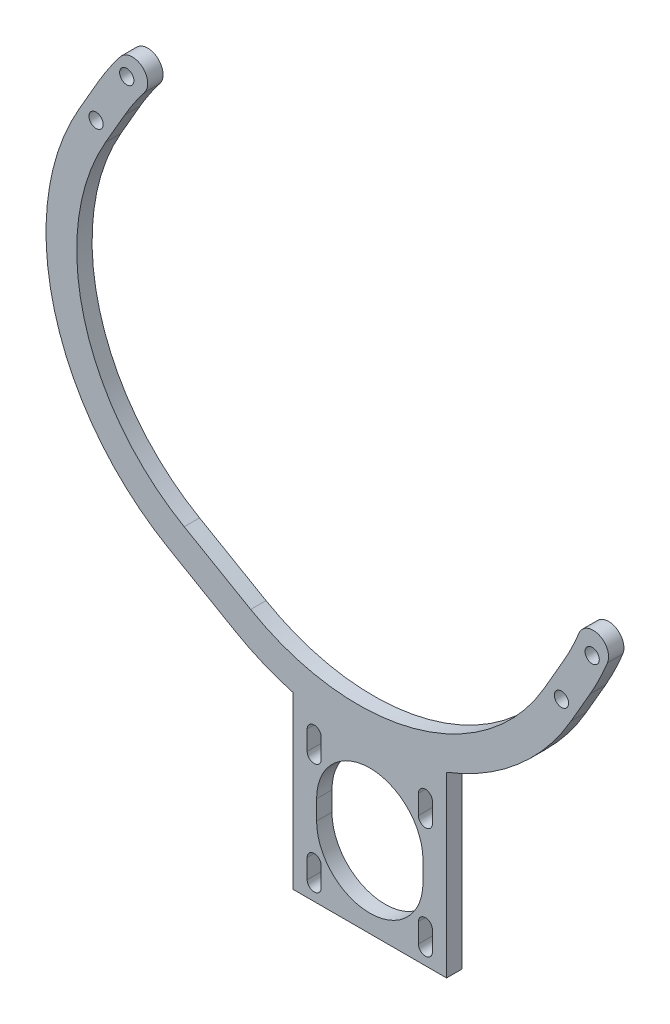
from build123d import *

# Parameters (mm, degrees)
BOSS_EXTRUDE1_DEPTH      = 3.175
BOSS_EXTRUDE2_DEPTH      = 3.175
BOSS_EXTRUDE2_DEPTH_BACK = 34.925
SKETCH2_W                = 31.75
SKETCH2_H                = 3.175
CUT_EXTRUDE1_DEPTH       = 111.671398355
F_4_CLEARANCE_HOLE1_D    = 2.9464


with BuildPart() as part:
    # Sketch1 → Boss-Extrude1 (new body)
    with BuildSketch(Plane(origin=(0, 0, -14.15699402), x_dir=(-1, 0, 0), z_dir=(0, 0, -1))):
        with BuildLine():
            Line((-49.172312317, -34.502108483), (-53.141062317, -27.628031841))
            ThreePointArc((-53.141062317, -27.628031841), (-55.063803638, -24.012221257), (-56.72992661, -20.271224785))
            ThreePointArc((-56.72992661, -20.271224785), (-54.976138042, -16.13776671), (-50.842679967, -17.891555277))
            ThreePointArc((-50.842679967, -17.891555277), (-49.356678398, -21.228119699), (-47.641801003, -24.453031841))
            Line((-47.641801003, -24.453031841), (-43.673051003, -31.327108483))
            ThreePointArc((-43.673051003, -31.327108483), (-16.68272836, -52.037511462), (17.046778195, -47.596937682))
            Line((17.046778195, -47.596937682), (23.920854837, -43.628187682))
            Line((23.920854837, -43.628187682), (30.79493148, -39.659437682))
            ThreePointArc((30.79493148, -39.659437682), (51.505334458, -12.669115038), (47.064760678, 21.060391517))
            Line((47.064760678, 21.060391517), (43.096010678, 27.934468159))
            ThreePointArc((43.096010678, 27.934468159), (41.160593535, 31.032051618), (39.01404477, 33.987248938))
            ThreePointArc((39.01404477, 33.987248938), (39.561948355, 38.44382292), (44.018522337, 37.895919335))
            ThreePointArc((44.018522337, 37.895919335), (46.425258832, 34.58251628), (48.595271992, 31.109468159))
            Line((48.595271992, 31.109468159), (52.564021992, 24.235391517))
            ThreePointArc((52.564021992, 24.235391517), (57.638963455, -14.312615975), (33.96993148, -45.158698996))
            Line((33.96993148, -45.158698996), (27.095854837, -49.127448996))
            Line((27.095854837, -49.127448996), (20.221778195, -53.096198996))
            ThreePointArc((20.221778195, -53.096198996), (-18.326229296, -58.171140459), (-49.172312317, -34.502108483))
        make_face()
    extrude(amount=BOSS_EXTRUDE1_DEPTH)

    # Sketch2 → Boss-Extrude2 (add, two sides: drawn at the far end of the back side and taken through both)
    with BuildSketch(Plane(origin=(8.682443514, -58.42, 0), x_dir=(-1, 0, 0), z_dir=(0, 1, 0)).offset(-BOSS_EXTRUDE2_DEPTH_BACK)):
        with Locations((1.098025871, -15.74449402)):
            Rectangle(SKETCH2_W, SKETCH2_H)
    extrude(amount=BOSS_EXTRUDE2_DEPTH + BOSS_EXTRUDE2_DEPTH_BACK)

    # Sketch3 → Cut-Extrude1 (cut, through all)
    with BuildSketch(Plane(origin=(0, 0, -17.33199402), x_dir=(-1, 0, 0), z_dir=(0, 0, -1))):
        with BuildLine():
            Line((-20.534417629, -67.17), (-20.534417629, -63.17))
            ThreePointArc((-20.534417629, -63.17), (-19.084417629, -61.72), (-17.634417629, -63.17))
            Line((-17.634417629, -63.17), (-17.634417629, -67.17))
            ThreePointArc((-17.634417629, -67.17), (-19.084417629, -68.62), (-20.534417629, -67.17))
        make_face()
        with BuildLine():
            Line((2.465582371, -67.17), (2.465582371, -63.17))
            ThreePointArc((2.465582371, -63.17), (3.915582371, -61.72), (5.365582371, -63.17))
            Line((5.365582371, -63.17), (5.365582371, -67.17))
            ThreePointArc((5.365582371, -67.17), (3.915582371, -68.62), (2.465582371, -67.17))
        make_face()
        with BuildLine():
            Line((-20.534417629, -90.17), (-20.534417629, -86.17))
            ThreePointArc((-20.534417629, -86.17), (-19.084417629, -84.72), (-17.634417629, -86.17))
            Line((-17.634417629, -86.17), (-17.634417629, -90.17))
            ThreePointArc((-17.634417629, -90.17), (-19.084417629, -91.62), (-20.534417629, -90.17))
        make_face()
        with BuildLine():
            Line((2.465582371, -90.17), (2.465582371, -86.17))
            ThreePointArc((2.465582371, -86.17), (3.915582371, -84.72), (5.365582371, -86.17))
            Line((5.365582371, -86.17), (5.365582371, -90.17))
            ThreePointArc((5.365582371, -90.17), (3.915582371, -91.62), (2.465582371, -90.17))
        make_face()
        with BuildLine():
            Line((-18.584417642, -78.67), (-18.584417642, -74.67))
            ThreePointArc((-18.584417642, -74.67), (-7.584417642, -63.67), (3.415582358, -74.67))
            Line((3.415582358, -74.67), (3.415582358, -78.67))
            ThreePointArc((3.415582358, -78.67), (-7.584417642, -89.67), (-18.584417642, -78.67))
        make_face()
    extrude(amount=-CUT_EXTRUDE1_DEPTH, mode=Mode.SUBTRACT)

    # #4 Clearance Hole1 (through all)
    with Locations(Plane(origin=(0, 0, -17.33199402), x_dir=(-1, 0, 0), z_dir=(0, 0, -1))):
        with Locations((-53.56643166, -20.541270527), (-47.21643166, -31.539793155), (42.670641335, 35.021229473), (49.020641335, 24.022706845)):
            Hole(F_4_CLEARANCE_HOLE1_D / 2)


solid = part.part
